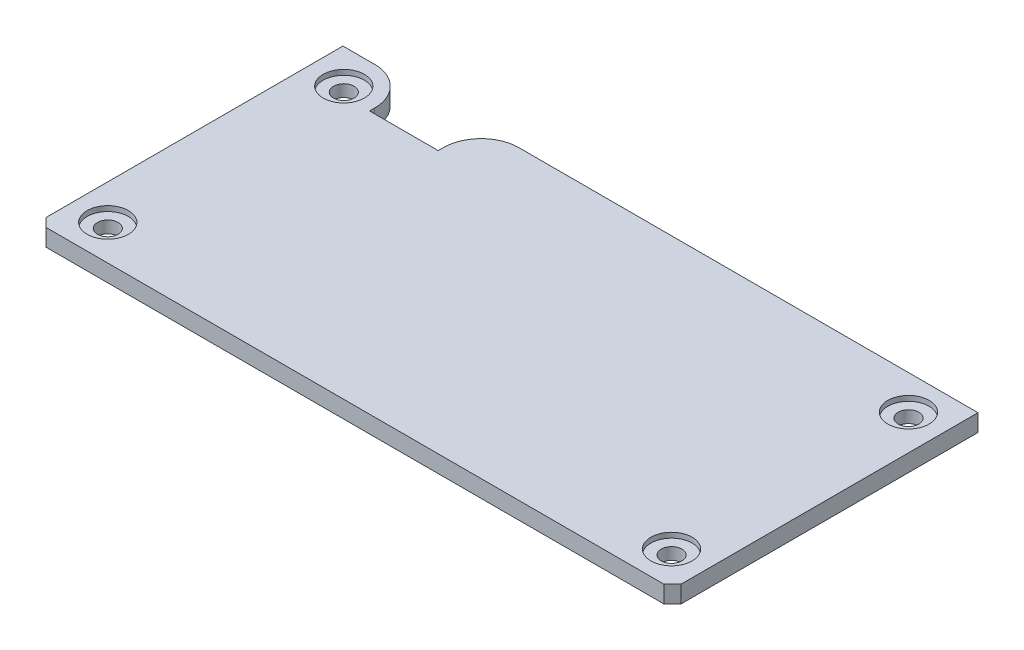
from build123d import *

# Parameters (mm, degrees)
SKETCH_1_W          = 74
SKETCH_1_H          = 35.6
EXTRUDE_1_DEPTH     = 2
CHAMFER_1_SIZE      = 1
SKETCH_2_R          = 1.2
CUT_EXTRUDE_1_DEPTH = 42.107663519
SKETCH_3_R          = 2.4
CUT_EXTRUDE_2_DEPTH = 0.6
SKETCH_5_W          = 8
SKETCH_5_H          = 5
CUT_EXTRUDE_3_DEPTH = 42.107663519
FILLET_1_R          = 4.4


with BuildPart() as part:
    # 草图1 → 凸台-拉伸1 (new body)
    with BuildSketch(Plane(origin=(0, 0, 0), x_dir=(1, 0, 0), z_dir=(0, 1, 0))):
        Rectangle(SKETCH_1_W, SKETCH_1_H)
    extrude(amount=EXTRUDE_1_DEPTH)

    # 倒角1
    chamfer_1_edges = [part.edges().sort_by_distance(p)[0] for p in [
        (37, 1, 17.8),
        (-37, 1, 17.8),
    ]]
    chamfer(chamfer_1_edges, length=CHAMFER_1_SIZE)

    # 草图2 → 切除-拉伸1 (cut, through all)
    with BuildSketch(Plane(origin=(0, 2, 0), x_dir=(1, 0, 0), z_dir=(0, 1, 0))):
        with Locations(Location((32.904560765, -13.813886845, 0), (0, 0, 270))):
            Circle(SKETCH_2_R)
        with Locations(Location((-32.9, -13.7, 0), (0, 0, 270))):
            Circle(SKETCH_2_R)
        with Locations(Location((-32.9, 13.799098008, 0), (0, 0, 270))):
            Circle(SKETCH_2_R)
        with Locations(Location((32.9, 13.799098008, 0), (0, 0, 270))):
            Circle(SKETCH_2_R)
    extrude(amount=-CUT_EXTRUDE_1_DEPTH, mode=Mode.SUBTRACT)

    # 草图3 → 切除-拉伸2 (cut)
    with BuildSketch(Plane(origin=(0, 2, 0), x_dir=(1, 0, 0), z_dir=(0, 1, 0))):
        with Locations(Location((32.904560765, -13.813886845, 0), (0, 0, 270))):
            Circle(SKETCH_3_R)
        with Locations(Location((-32.9, -13.7, 0), (0, 0, 270))):
            Circle(SKETCH_3_R)
        with Locations(Location((32.9, 13.799098008, 0), (0, 0, 270))):
            Circle(SKETCH_3_R)
        with Locations(Location((-32.9, 13.799098008, 0), (0, 0, 270))):
            Circle(SKETCH_3_R)
    extrude(amount=-CUT_EXTRUDE_2_DEPTH, mode=Mode.SUBTRACT)

    # 草图5 → 切除-拉伸3 (cut, through all)
    with BuildSketch(Plane(origin=(0, 2, 0), x_dir=(1, 0, 0), z_dir=(0, 1, 0))):
        with Locations((-24.9, 15.3)):
            Rectangle(SKETCH_5_W, SKETCH_5_H)
    extrude(amount=-CUT_EXTRUDE_3_DEPTH, mode=Mode.SUBTRACT)

    # 圆角1
    fillet_1_edges = [part.edges().sort_by_distance(p)[0] for p in [
        (-20.9, 1, -17.8),
        (-28.9, 1, -17.8),
    ]]
    fillet(fillet_1_edges, radius=FILLET_1_R)


solid = part.part
